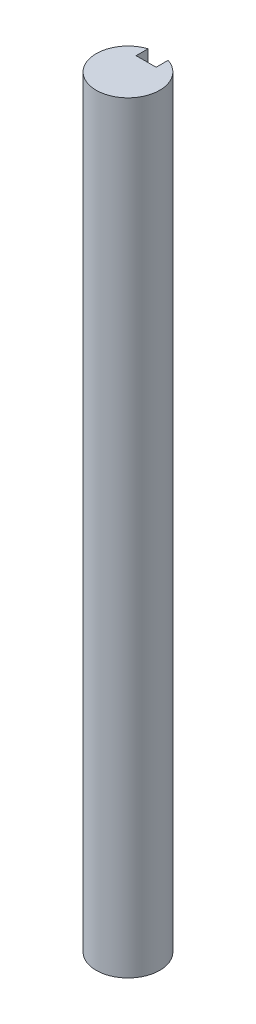
from build123d import *

# Parameters (mm, degrees)
BOSS_EXTRUDE1_DEPTH = 76.2


with BuildPart() as part:
    # Sketch1 → Boss-Extrude1 (new body)
    with BuildSketch(Plane(origin=(0, 0, 0), x_dir=(1, 0, 0), z_dir=(0, 1, 0))):
        with BuildLine():
            Line((-1, 3.01340754), (-1, 1.81340754))
            Line((-1, 1.81340754), (1, 1.81340754))
            Line((1, 1.81340754), (1, 3.01340754))
            ThreePointArc((1, 3.01340754), (0, -3.175), (-1, 3.01340754))
        make_face()
    extrude(amount=BOSS_EXTRUDE1_DEPTH)


solid = part.part
